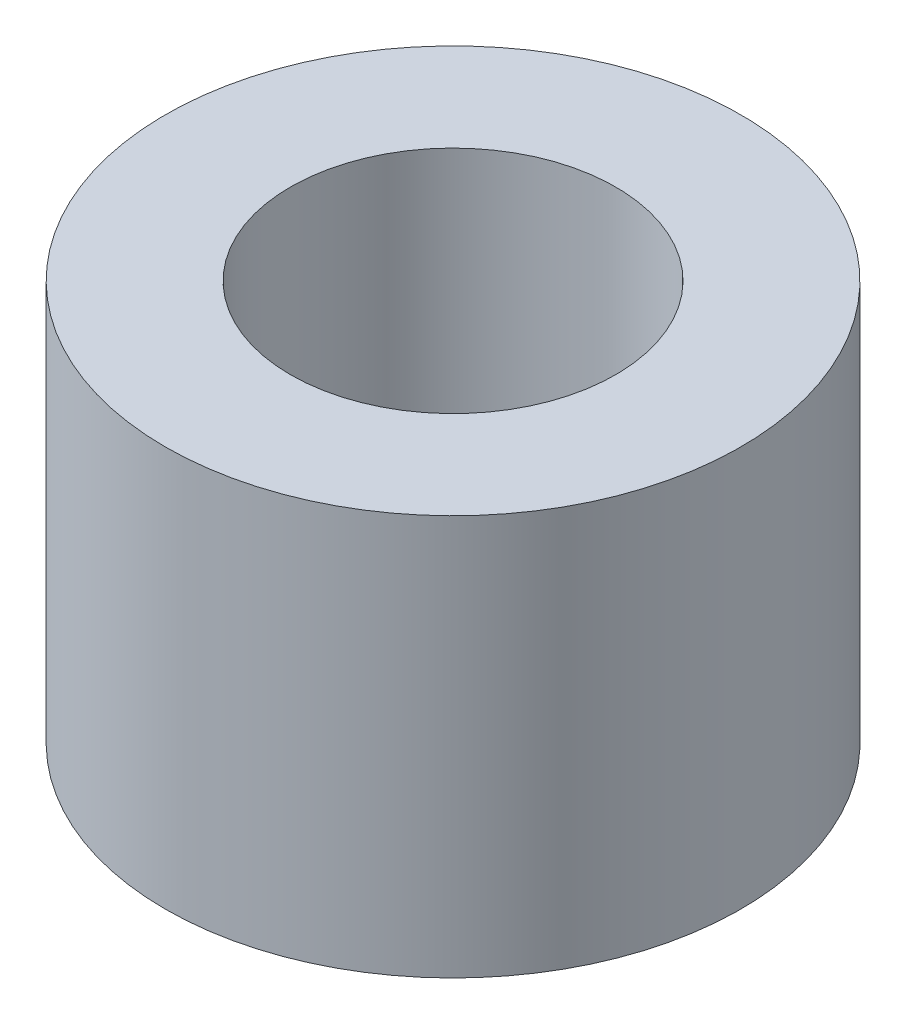
from build123d import *

# Parameters (mm, degrees)
SKETCH1_R           = 2.3
SKETCH1_R_2         = 1.3
BOSS_EXTRUDE1_DEPTH = 1.6


with BuildPart() as part:
    # Sketch1 → Boss-Extrude1 (new, symmetric)
    with BuildSketch(Plane(origin=(0, 0, 0), x_dir=(1, 0, 0), z_dir=(0, 1, 0))):
        with Locations(Location((0, 0, 0), (0, 0, 270))):
            Circle(SKETCH1_R)
        with Locations(Location((0, 0, 0), (0, 0, 270))):
            Circle(SKETCH1_R_2, mode=Mode.SUBTRACT)
    extrude(amount=BOSS_EXTRUDE1_DEPTH, both=True)


solid = part.part
